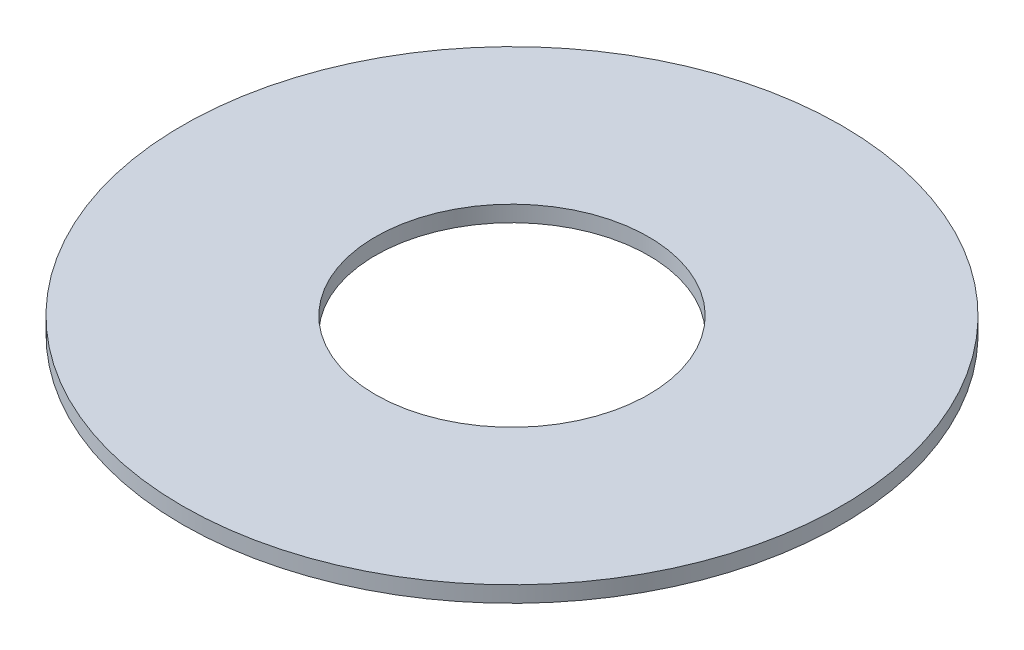
from build123d import *

# Parameters (mm, degrees)
SKETCH1_R           = 41
SKETCH1_R_2         = 17
BOSS_EXTRUDE1_DEPTH = 2


with BuildPart() as part:
    # Sketch1 → Boss-Extrude1 (new body)
    with BuildSketch(Plane(origin=(0, 0, 0), x_dir=(1, 0, 0), z_dir=(0, 1, 0))):
        with Locations(Location((0, 0, 0), (0, 0, 270))):
            Circle(SKETCH1_R)
        with Locations(Location((0, 0, 0), (0, 0, 270))):
            Circle(SKETCH1_R_2, mode=Mode.SUBTRACT)
    extrude(amount=BOSS_EXTRUDE1_DEPTH)


solid = part.part
